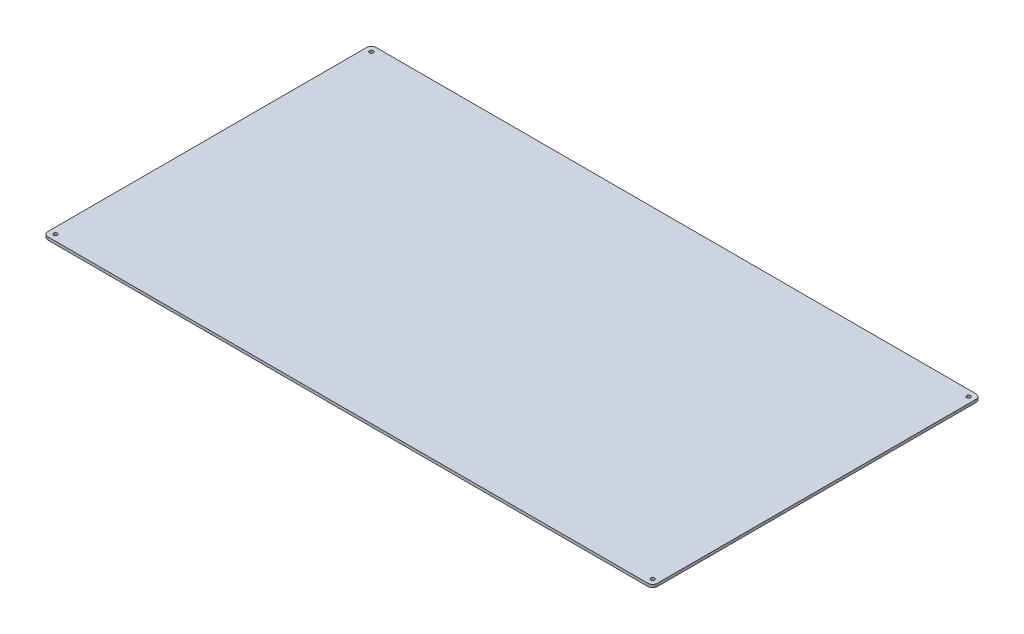
from build123d import *

# Parameters (mm, degrees)
SKETCH_1_R      = 2
EXTRUDE_1_DEPTH = 3


with BuildPart() as part:
    # 草图1 → 凸台-拉伸1 (new body)
    with BuildSketch(Plane(origin=(0, 0, 0), x_dir=(1, 0, 0), z_dir=(0, 1, 0))):
        with BuildLine():
            Line((5, 0), (645, 0))
            ThreePointArc((645, 0), (648.535533906, 1.464466094), (650, 5))
            Line((650, 5), (650, 345))
            ThreePointArc((650, 345), (648.535533906, 348.535533906), (645, 350))
            Line((645, 350), (5, 350))
            ThreePointArc((5, 350), (1.464466094, 348.535533906), (0, 345))
            Line((0, 345), (0, 5))
            ThreePointArc((0, 5), (1.464466094, 1.464466094), (5, 0))
        make_face()
        with Locations(Location((6.5, 343.5, 0), (0, 0, 270))):
            Circle(SKETCH_1_R, mode=Mode.SUBTRACT)
        with Locations(Location((643.5, 343.5, 0), (0, 0, 270))):
            Circle(SKETCH_1_R, mode=Mode.SUBTRACT)
        with Locations(Location((643.5, 6.5, 0), (0, 0, 270))):
            Circle(SKETCH_1_R, mode=Mode.SUBTRACT)
        with Locations(Location((6.5, 6.5, 0), (0, 0, 270))):
            Circle(SKETCH_1_R, mode=Mode.SUBTRACT)
    extrude(amount=EXTRUDE_1_DEPTH)


solid = part.part
